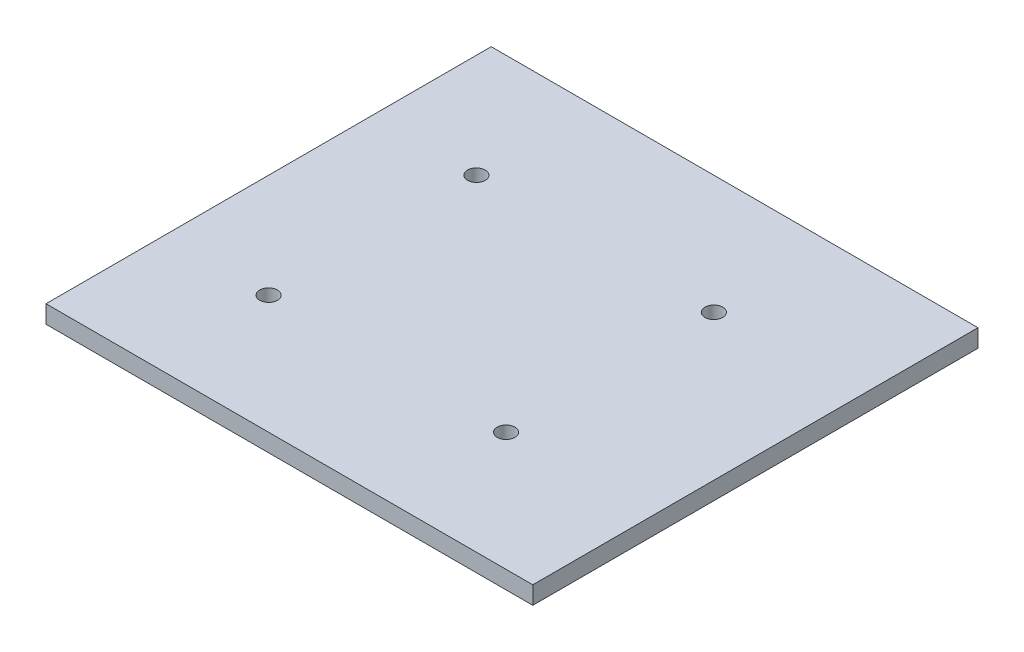
from build123d import *

# Parameters (mm, degrees)
SKETCH1_W           = 82
SKETCH1_H           = 75
BOSS_EXTRUDE1_DEPTH = 3
SKETCH5_R           = 1.5
CUT_EXTRUDE2_DEPTH  = 3


with BuildPart() as part:
    # Sketch1 → Boss-Extrude1 (new body)
    with BuildSketch(Plane(origin=(0, 0, 0), x_dir=(1, 0, 0), z_dir=(0, 1, 0))):
        with Locations((41, 37.5)):
            Rectangle(SKETCH1_W, SKETCH1_H)
    extrude(amount=BOSS_EXTRUDE1_DEPTH)

    # Sketch5 → Cut-Extrude2 (cut)
    with BuildSketch(Plane(origin=(0, 3, 0), x_dir=(1, 0, 0), z_dir=(0, 1, 0))):
        with Locations(Location((17.5, 55, 0), (0, 0, 270))):
            Circle(SKETCH5_R)
        with Locations(Location((57.5, 55, 0), (0, 0, 270))):
            Circle(SKETCH5_R)
        with Locations(Location((17.5, 20, 0), (0, 0, 270))):
            Circle(SKETCH5_R)
        with Locations(Location((57.5, 20, 0), (0, 0, 270))):
            Circle(SKETCH5_R)
    extrude(amount=-CUT_EXTRUDE2_DEPTH, mode=Mode.SUBTRACT)


solid = part.part
